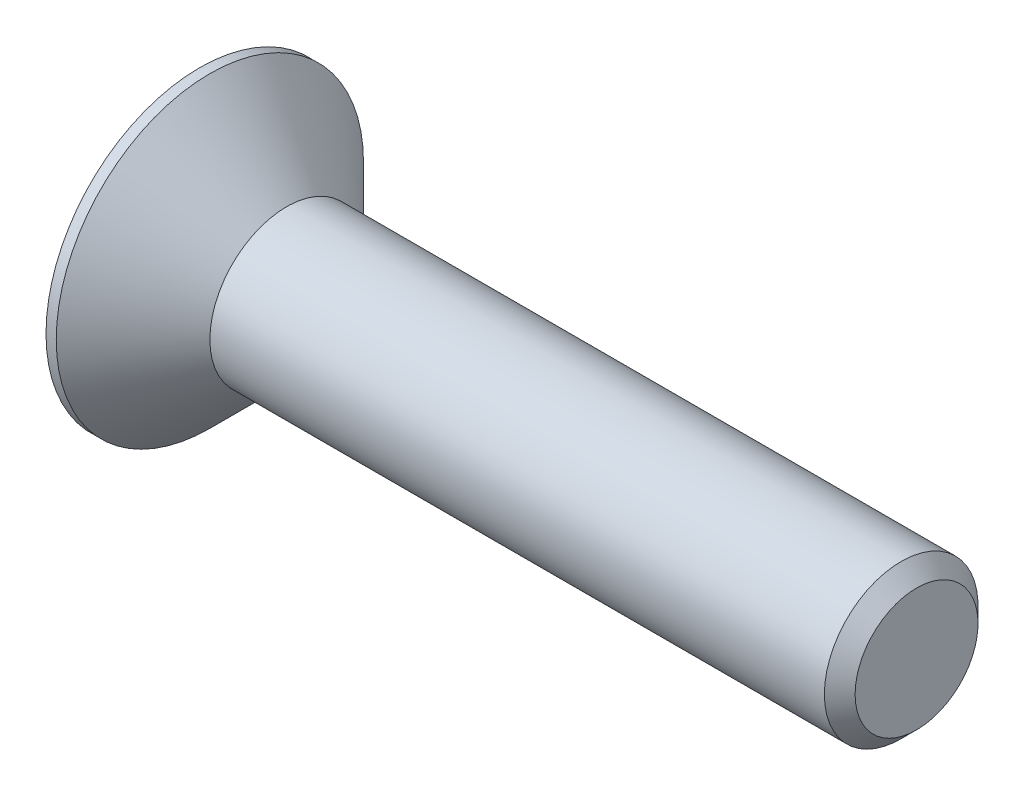
from build123d import *

# Parameters (mm, degrees)
CHANFREIN1_SIZE         = 0.3
ENL_V_MAT_EXTRU_1_DEPTH = 0.75


with BuildPart() as part:
    # Esquisse1 → Révolution1 (revolve)
    with BuildSketch(Plane.XY, mode=Mode.PRIVATE) as r_volution1_sk:
        Polygon((0, 0), (14, 0), (14, 1.5), (1.7, 1.5), (0.2, 3), (0, 3), align=None)
    revolve(r_volution1_sk.sketch.rotate(Axis((0, 0, 0), (1, 0, 0)), 90), axis=Axis((0, 0, 0), (1, 0, 0)))

    # Chanfrein1
    chanfrein1_edges = [part.edges().sort_by_distance(p)[0] for p in [
        (14, 0, -1.5),
    ]]
    chamfer(chanfrein1_edges, length=CHANFREIN1_SIZE)

    # Esquisse2 → Enlèv. mat.-Extru.1 (cut)
    with BuildSketch(Plane.ZY):
        Polygon((0.577350269, -1), (1.154700538, 0), (0.577350269, 1), (-0.577350269, 1), (-1.154700538, 0), (-0.577350269, -1), align=None)
    extrude(amount=-ENL_V_MAT_EXTRU_1_DEPTH, mode=Mode.SUBTRACT)


solid = part.part
